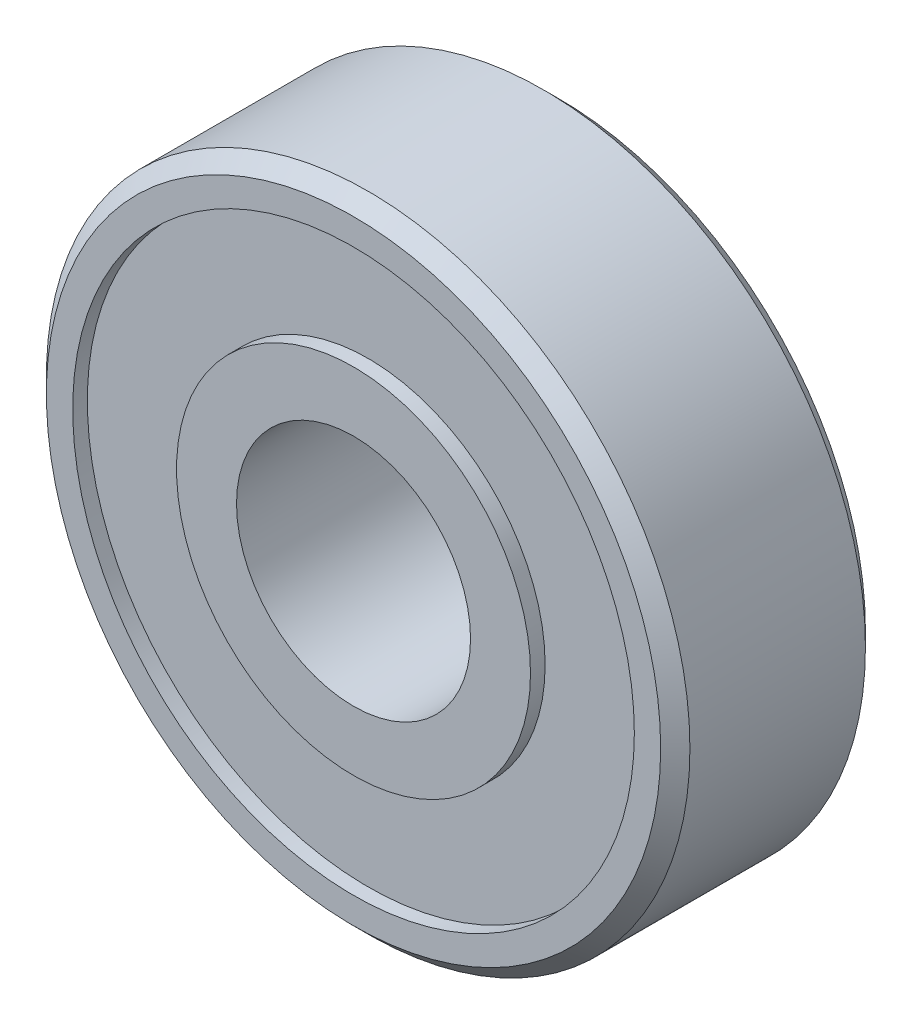
from build123d import *

# Parameters (mm, degrees)
SKETCH_1_R          = 11
SKETCH_1_R_2        = 4
EXTRUDE_1_DEPTH     = 3.5
CHAMFER_1_SIZE      = 0.5
SKETCH_2_R          = 9.6
SKETCH_2_R_2        = 6.05
CUT_EXTRUDE_1_DEPTH = 0.5


with BuildPart() as part:
    # 스케치1 → 보스-돌출1 (new, symmetric)
    with BuildSketch(Plane.XY):
        Circle(SKETCH_1_R)
        Circle(SKETCH_1_R_2, mode=Mode.SUBTRACT)
    extrude(amount=EXTRUDE_1_DEPTH, both=True)

    # 모따기1
    chamfer_1_edges = [part.edges().sort_by_distance(p)[0] for p in [
        (-11, 0, -3.5),
        (-11, 0, 3.5),
    ]]
    chamfer(chamfer_1_edges, length=CHAMFER_1_SIZE)

    # 스케치2 → 컷-돌출1 (cut)
    with BuildSketch(Plane.XY.offset(3.5)):
        Circle(SKETCH_2_R)
        Circle(SKETCH_2_R_2, mode=Mode.SUBTRACT)
    cut_extrude_1 = extrude(amount=-CUT_EXTRUDE_1_DEPTH, mode=Mode.SUBTRACT)

    # 대칭 복사1: 컷-돌출1 across plane
    add(cut_extrude_1.mirror(Plane.XY), mode=Mode.SUBTRACT)


solid = part.part
